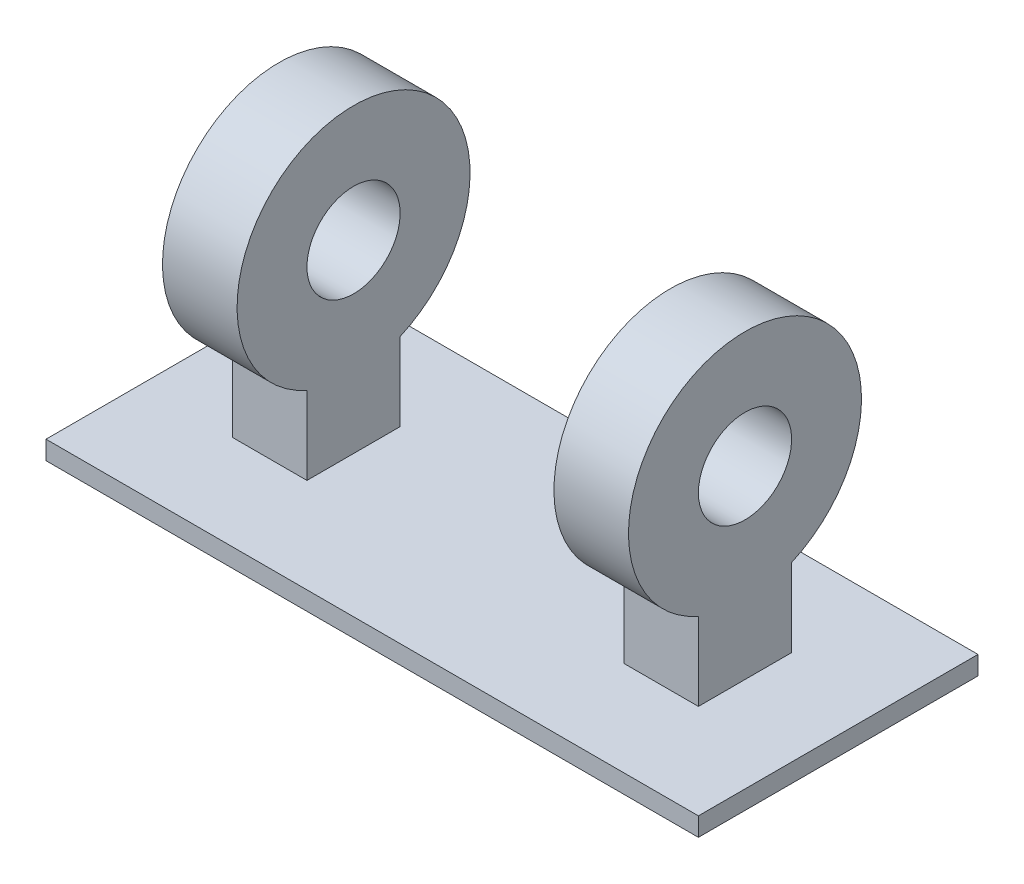
from build123d import *

# Parameters (mm, degrees)
SKETCH1_W           = 70
SKETCH1_H           = 30
BOSS_EXTRUDE1_DEPTH = 2
SKETCH2_R           = 5
BOSS_EXTRUDE2_DEPTH = 8


with BuildPart() as part:
    # Sketch1 → Boss-Extrude1 (new body)
    with BuildSketch(Plane(origin=(0, 0, 0), x_dir=(1, 0, 0), z_dir=(0, 1, 0))):
        Rectangle(SKETCH1_W, SKETCH1_H)
    extrude(amount=BOSS_EXTRUDE1_DEPTH)


with BuildPart() as body_2:
    # Sketch2 → Boss-Extrude2 (new body)
    with BuildSketch(Plane.ZY.offset(25)):
        with BuildLine():
            Line((-5, 10.543560763), (-5, 7.057167062))
            Line((-5, 7.057167062), (-5, 2.166493233))
            Line((-5, 2.166493233), (5, 2.166493233))
            Line((5, 2.166493233), (5, 7.057167062))
            Line((5, 7.057167062), (5, 10.543560763))
            ThreePointArc((5, 10.543560763), (0, 34.5), (-5, 10.543560763))
        make_face()
        with Locations((0, 22)):
            Circle(SKETCH2_R, mode=Mode.SUBTRACT)
    extrude(amount=-BOSS_EXTRUDE2_DEPTH)


with BuildPart() as body_3:
    # Mirror3: mirrored copy
    add(body_2.part.mirror(Plane.ZY))


solid = Compound([part.part, body_2.part, body_3.part])
